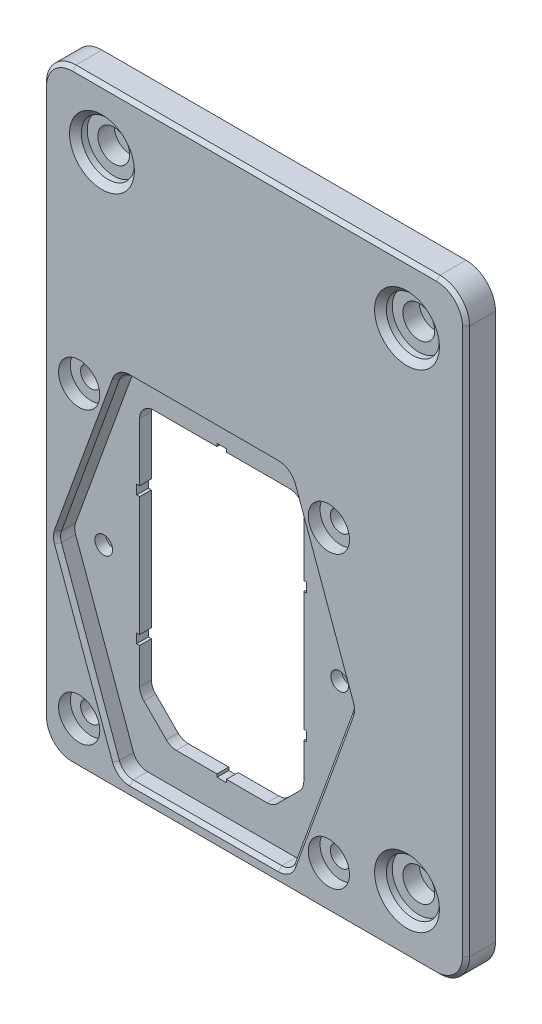
from build123d import *

# Parameters (mm, degrees)
SZKIC1_W                        = 71.725484412
SZKIC1_H                        = 102.625
SZKIC1_R                        = 2.7
SZKIC1_R_2                      = 1.5
DODANIE_WYCI_GNI_CIE1_DEPTH     = 5
WYTNIJ_WYCI_GNI_CIE1_START      = 5
WYTNIJ_WYCI_GNI_CIE1_DEPTH      = 3
SZKIC2_R                        = 4.5
WYTNIJ_WYCI_GNI_CIE2_DEPTH      = 2
ZAOKR_GLENIE1_R                 = 5
SFAZOWANIE2_SIZE                = 1
SZKIC4_R                        = 1.75
WYTNIJ_WYCI_GNI_CIE3_DEPTH      = 83.181434095
SZKIC5_R                        = 3.5
WYTNIJ_WYCI_GNI_CIE4_DEPTH      = 2
SFAZOWANIE3_SIZE                = 0.6
SZKIC8_R                        = 2.7
SZKIC8_R_2                      = 1.75
SZKIC8_R_3                      = 1.5
DODANIE_WYCI_GNI_CIE2_DEPTH     = 0.2
WYTNIJ_WYCI_GNI_CIE5_DEPTH      = 167.708717442
WYTNIJ_WYCI_GNI_CIE5_DEPTH_BACK = 167.708717442


with BuildPart() as part:
    # Szkic1 → Dodanie-wyciągnięcie1 (new body)
    with BuildSketch(Plane.XY):
        with Locations((-28.085426569, -0.062784138)):
            Rectangle(SZKIC1_W, SZKIC1_H)
        with Locations((-53.948168775, -41.375284138)):
            Circle(SZKIC1_R, mode=Mode.SUBTRACT)
        with Locations((-2.222684363, -41.375284138)):
            Circle(SZKIC1_R, mode=Mode.SUBTRACT)
        with Locations((-2.222684363, 41.249715862)):
            Circle(SZKIC1_R, mode=Mode.SUBTRACT)
        with BuildLine():
            Line((-22.230303443, 29.274715862), (-22.730303443, 29.274715862))
            Line((-22.730303443, 29.274715862), (-22.730303443, 9.024715862))
            Line((-22.730303443, 9.024715862), (-22.230303443, 9.024715862))
            Line((-22.230303443, 9.024715862), (-22.230303443, 7.424715862))
            Line((-22.230303443, 7.424715862), (-22.730303443, 7.424715862))
            Line((-22.730303443, 7.424715862), (-22.730303443, -2.475284138))
            ThreePointArc((-22.730303443, -2.475284138), (-23.433247168, -4.172340413), (-25.130303443, -4.875284138))
            Line((-25.130303443, -4.875284138), (-35.845303443, -4.875284138))
            Line((-35.845303443, -4.875284138), (-35.845303443, -5.375284138))
            Line((-35.845303443, -5.375284138), (-37.445303443, -5.375284138))
            Line((-37.445303443, -5.375284138), (-37.445303443, -4.875284138))
            Line((-37.445303443, -4.875284138), (-48.160303443, -4.875284138))
            ThreePointArc((-48.160303443, -4.875284138), (-49.857359718, -4.172340413), (-50.560303443, -2.475284138))
            Line((-50.560303443, -2.475284138), (-50.560303443, 7.424715862))
            Line((-50.560303443, 7.424715862), (-51.060303443, 7.424715862))
            Line((-51.060303443, 7.424715862), (-51.060303443, 9.024715862))
            Line((-51.060303443, 9.024715862), (-50.560303443, 9.024715862))
            Line((-50.560303443, 9.024715862), (-50.560303443, 29.274715862))
            Line((-50.560303443, 29.274715862), (-51.060303443, 29.274715862))
            Line((-51.060303443, 29.274715862), (-51.060303443, 30.874715862))
            Line((-51.060303443, 30.874715862), (-50.560303443, 30.874715862))
            Line((-50.560303443, 30.874715862), (-50.560303443, 36.946288737))
            ThreePointArc((-50.560303443, 36.946288737), (-50.377614321, 37.864728975), (-49.857359718, 38.643345012))
            Line((-49.857359718, 38.643345012), (-46.028932593, 42.471772136))
            ThreePointArc((-46.028932593, 42.471772136), (-45.250316556, 42.99202674), (-44.331876318, 43.174715862))
            Line((-44.331876318, 43.174715862), (-37.445303443, 43.174715862))
            Line((-37.445303443, 43.174715862), (-37.445303443, 43.674715862))
            Line((-37.445303443, 43.674715862), (-35.845303443, 43.674715862))
            Line((-35.845303443, 43.674715862), (-35.845303443, 43.174715862))
            Line((-35.845303443, 43.174715862), (-28.958730568, 43.174715862))
            ThreePointArc((-28.958730568, 43.174715862), (-28.04029033, 42.99202674), (-27.261674293, 42.471772136))
            Line((-27.261674293, 42.471772136), (-23.433247168, 38.643345012))
            ThreePointArc((-23.433247168, 38.643345012), (-22.912992565, 37.864728975), (-22.730303443, 36.946288737))
            Line((-22.730303443, 36.946288737), (-22.730303443, 30.874715862))
            Line((-22.730303443, 30.874715862), (-22.230303443, 30.874715862))
            Line((-22.230303443, 30.874715862), (-22.230303443, 29.274715862))
        make_face(mode=Mode.SUBTRACT)
        with Locations((-16.645303443, 19.149715862)):
            Circle(SZKIC1_R_2, mode=Mode.SUBTRACT)
        with Locations((-56.645303443, 19.149715862)):
            Circle(SZKIC1_R_2, mode=Mode.SUBTRACT)
    extrude(amount=DODANIE_WYCI_GNI_CIE1_DEPTH)

    # Szkic1<3> → Wytnij-wyciągnięcie1 (cut)
    with BuildSketch(Plane.XY.offset(WYTNIJ_WYCI_GNI_CIE1_START)):
        with BuildLine():
            Line((-51.593316248, 47.101803403), (-61.418230337, 20.001803403))
            ThreePointArc((-61.418230337, 20.001803403), (-61.567922523, 19.149715862), (-61.418230337, 18.297628321))
            Line((-61.418230337, 18.297628321), (-51.593316248, -8.802371679))
            ThreePointArc((-51.593316248, -8.802371679), (-50.678240322, -9.997259816), (-49.243008434, -10.450284138))
            Line((-49.243008434, -10.450284138), (-24.047598452, -10.450284138))
            ThreePointArc((-24.047598452, -10.450284138), (-22.612366563, -9.997259816), (-21.697290637, -8.802371679))
            Line((-21.697290637, -8.802371679), (-11.872376548, 18.297628321))
            ThreePointArc((-11.872376548, 18.297628321), (-11.722684363, 19.149715862), (-11.872376548, 20.001803403))
            Line((-11.872376548, 20.001803403), (-21.697290637, 47.101803403))
            ThreePointArc((-21.697290637, 47.101803403), (-22.612366563, 48.29669154), (-24.047598452, 48.749715862))
            Line((-24.047598452, 48.749715862), (-49.243008434, 48.749715862))
            ThreePointArc((-49.243008434, 48.749715862), (-50.678240322, 48.29669154), (-51.593316248, 47.101803403))
        make_face()
    extrude(amount=-WYTNIJ_WYCI_GNI_CIE1_DEPTH, mode=Mode.SUBTRACT)

    # Szkic2 → Wytnij-wyciągnięcie2 (cut)
    with BuildSketch(Plane.XY.offset(5)):
        with Locations((-2.222684363, 41.249715862)):
            Circle(SZKIC2_R)
        with Locations((-2.222684363, -41.375284138)):
            Circle(SZKIC2_R)
        with Locations((-53.948168775, -41.375284138)):
            Circle(SZKIC2_R)
    extrude(amount=-WYTNIJ_WYCI_GNI_CIE2_DEPTH, mode=Mode.SUBTRACT)

    # Zaokrąglenie1
    zaokr_glenie1_edges = [part.edges().sort_by_distance(p)[0] for p in [
        (-63.948168775, 51.249715862, 2.5),
        (7.777315637, 51.249715862, 2.5),
        (7.777315637, -51.375284138, 2.5),
        (-63.948168775, -51.375284138, 2.5),
    ]]
    fillet(zaokr_glenie1_edges, radius=ZAOKR_GLENIE1_R)

    # Sfazowanie2
    sfazowanie2_edges = [part.edges().sort_by_distance(p)[0] for p in [
        (-6.722684363, 41.249715862, 5),
        (-6.722684363, -41.375284138, 5),
        (-58.448168775, -41.375284138, 5),
    ]]
    chamfer(sfazowanie2_edges, length=SFAZOWANIE2_SIZE)

    # Szkic4 → Wytnij-wyciągnięcie3 (cut, through all)
    with BuildSketch(Plane(origin=(0, 0, 0), x_dir=(-1, 0, 0), z_dir=(0, 0, -1))):
        with Locations((15.472684363, -5.450284138)):
            Circle(SZKIC4_R)
        with Locations(Location((15.472684363, 43.749715862, 0), (0, 0, 180))):
            Circle(SZKIC4_R)
        with Locations((57.817922523, 43.749715862)):
            Circle(SZKIC4_R)
        with Locations((57.817922523, -5.450284138)):
            Circle(SZKIC4_R)
    extrude(amount=-WYTNIJ_WYCI_GNI_CIE3_DEPTH, mode=Mode.SUBTRACT)

    # Szkic5 → Wytnij-wyciągnięcie4 (cut)
    with BuildSketch(Plane.XY.offset(5)):
        with Locations((-15.472684363, 43.749715862)):
            Circle(SZKIC5_R)
        with Locations((-15.472684363, -5.450284138)):
            Circle(SZKIC5_R)
        with Locations((-57.817922523, -5.450284138)):
            Circle(SZKIC5_R)
        with Locations((-57.817922523, 43.749715862)):
            Circle(SZKIC5_R)
    extrude(amount=-WYTNIJ_WYCI_GNI_CIE4_DEPTH, mode=Mode.SUBTRACT)

    # Sfazowanie3
    sfazowanie3_edges = [part.edges().sort_by_distance(p)[0] for p in [
        (-16.784833593, 4.747628321, 5),
        (-36.645303443, -10.450284138, 5),
        (-56.505773293, 4.747628321, 5),
        (-56.505773293, 33.551803403, 5),
        (-36.645303443, 48.749715862, 5),
        (-16.784833593, 33.551803403, 5),
        (-11.722684363, 19.149715862, 5),
        (-22.612366563, 48.29669154, 5),
        (-50.678240322, 48.29669154, 5),
        (-61.567922523, 19.149715862, 5),
        (-50.678240322, -9.997259816, 5),
        (-22.612366563, -9.997259816, 5),
        (-28.085426569, -51.375284138, 5),
        (-63.948168775, -0.062784138, 5),
        (7.777315637, -0.062784138, 5),
        (-28.085426569, 51.249715862, 5),
        (-62.48370268, 49.785249768, 5),
        (6.312849543, 49.785249768, 5),
        (6.312849543, -49.910818044, 5),
        (-62.48370268, -49.910818044, 5),
    ]]
    chamfer(sfazowanie3_edges, length=SFAZOWANIE3_SIZE)

    # Szkic8 → Dodanie-wyciągnięcie2 (add)
    with BuildSketch(Plane(origin=(0, 0, 0), x_dir=(-1, 0, 0), z_dir=(0, 0, -1))):
        with Locations((2.222684363, -41.375284138)):
            Circle(SZKIC8_R)
        with Locations((53.948168775, -41.375284138)):
            Circle(SZKIC8_R)
        with Locations((2.222684363, 41.249715862)):
            Circle(SZKIC8_R)
        with Locations((57.817922523, 43.749715862)):
            Circle(SZKIC8_R_2)
        with Locations((56.645303443, 19.149715862)):
            Circle(SZKIC8_R_3)
        with Locations((57.817922523, -5.450284138)):
            Circle(SZKIC8_R_2)
        with Locations((15.472684363, -5.450284138)):
            Circle(SZKIC8_R_2)
        with Locations((16.645303443, 19.149715862)):
            Circle(SZKIC8_R_3)
        with Locations((15.472684363, 43.749715862)):
            Circle(SZKIC8_R_2)
    extrude(amount=-DODANIE_WYCI_GNI_CIE2_DEPTH)


with BuildPart() as body_2:
    # Lustro1: mirrored copy
    add(part.part.mirror(Plane(origin=(0, 51.249715862, 5), x_dir=(0, 0, 1), z_dir=(0, -1, 0))))


with BuildPart() as part_1:
    add(part.part)

    # Szkic9 → Wytnij-wyciągnięcie5 (cut, two sides: drawn at the far end of the back side and taken through both)
    with BuildSketch(Plane(origin=(0, 0, 0), x_dir=(-1, 0, 0), z_dir=(0, 0, -1)).offset(-WYTNIJ_WYCI_GNI_CIE5_DEPTH_BACK)):
        with BuildLine():
            Line((-2.777315637, -51.375284138), (58.948168775, -51.375284138))
            ThreePointArc((58.948168775, -51.375284138), (62.48370268, -49.910818044), (63.948168775, -46.375284138))
            Line((63.948168775, -46.375284138), (63.948168775, 46.249715862))
            ThreePointArc((63.948168775, 46.249715862), (62.48370268, 49.785249768), (58.948168775, 51.249715862))
            Line((58.948168775, 51.249715862), (-2.777315637, 51.249715862))
            ThreePointArc((-2.777315637, 51.249715862), (-6.312849543, 49.785249768), (-7.777315637, 46.249715862))
            Line((-7.777315637, 46.249715862), (-7.777315637, -46.375284138))
            ThreePointArc((-7.777315637, -46.375284138), (-6.312849543, -49.910818044), (-2.777315637, -51.375284138))
        make_face()
    extrude(amount=WYTNIJ_WYCI_GNI_CIE5_DEPTH + WYTNIJ_WYCI_GNI_CIE5_DEPTH_BACK, mode=Mode.SUBTRACT)


solid = body_2.part
